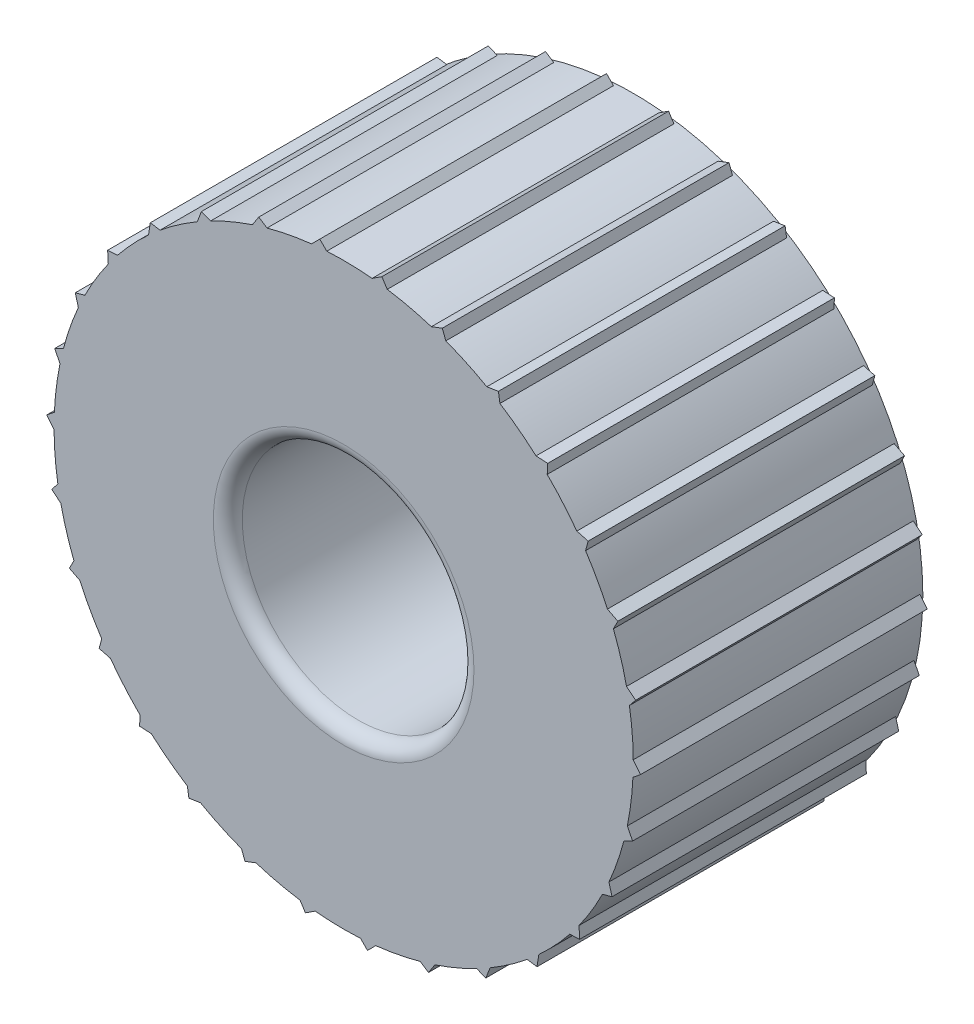
from build123d import *

# Parameters (mm, degrees)
SKETCH2_R           = 100
SKETCH2_R_2         = 50
BOSS_EXTRUDE2_DEPTH = 100
SKETCH3_R           = 50
BOSS_EXTRUDE3_DEPTH = 100
SKETCH4_R           = 40
CUT_EXTRUDE1_DEPTH  = 100
FILLET1_R           = 5
FILLET2_R           = 5
BOSS_EXTRUDE4_DEPTH = 99


with BuildPart() as part:
    # Sketch2 → Boss-Extrude2 (new body)
    with BuildSketch(Plane.XY):
        Circle(SKETCH2_R)
        Circle(SKETCH2_R_2, mode=Mode.SUBTRACT)
    extrude(amount=-BOSS_EXTRUDE2_DEPTH)

    # Sketch3 → Boss-Extrude3 (add)
    with BuildSketch(Plane.XY):
        Circle(SKETCH3_R)
    extrude(amount=-BOSS_EXTRUDE3_DEPTH)

    # Sketch4 → Cut-Extrude1 (cut)
    with BuildSketch(Plane.XY):
        Circle(SKETCH4_R)
    extrude(amount=-CUT_EXTRUDE1_DEPTH, mode=Mode.SUBTRACT)

    # Fillet1
    fillet1_edges = [part.edges().sort_by_distance(p)[0] for p in [
        (-40, 0, 0),
    ]]
    fillet(fillet1_edges, radius=FILLET1_R)

    # Fillet2
    fillet2_edges = [part.edges().sort_by_distance(p)[0] for p in [
        (-40, 0, -100),
    ]]
    fillet(fillet2_edges, radius=FILLET2_R)

    # Sketch9 → Boss-Extrude4 (add)
    with BuildSketch(Plane.XY):
        with BuildLine():
            Line((-11.094188182, 99.382689582), (-8.236971303, 102.239906461))
            Line((-8.236971303, 102.239906461), (-5.827142523, 99.830077682))
            ThreePointArc((-5.827142523, 99.830077682), (-8.463621993, 99.641191797), (-11.094188182, 99.382689582))
        make_face()
        with BuildLine():
            Line((13.199898104, 101.718281835), (15.056034767, 98.86008202))
            ThreePointArc((15.056034767, 98.86008202), (12.437897116, 99.22347865), (9.811069477, 99.517550792))
            Line((9.811069477, 99.517550792), (13.199898104, 101.718281835))
        make_face()
        with BuildLine():
            Line((34.059868624, 96.751080194), (35.281191091, 93.569426391))
            ThreePointArc((35.281191091, 93.569426391), (32.795820437, 94.469223358), (30.287536321, 95.303017495))
            Line((30.287536321, 95.303017495), (34.059868624, 96.751080194))
        make_face()
        with BuildLine():
            Line((53.431259448, 87.555392086), (53.964390067, 84.189337833))
            ThreePointArc((53.964390067, 84.189337833), (51.720409033, 85.586209692), (49.440292492, 86.923285018))
            Line((49.440292492, 86.923285018), (53.431259448, 87.555392086))
        make_face()
        with BuildLine():
            Line((70.467447842, 74.533113206), (70.289086246, 71.129771226))
            ThreePointArc((70.289086246, 71.129771226), (68.384567572, 72.962667974), (66.43227064, 74.744587882))
            Line((66.43227064, 74.744587882), (70.467447842, 74.533113206))
        make_face()
        with BuildLine():
            Line((84.423870625, 58.253379629), (83.541812073, 54.961492298))
            ThreePointArc((83.541812073, 54.961492298), (82.059992363, 57.150307552), (80.520839784, 59.299193591))
            Line((80.520839784, 59.299193591), (84.423870625, 58.253379629))
        make_face()
        with BuildLine():
            Line((94.690565151, 39.427693832), (93.143359833, 36.391132422))
            ThreePointArc((93.143359833, 36.391132422), (92.14900172, 38.840204453), (91.090261847, 41.262139991))
            Line((91.090261847, 41.262139991), (94.690565151, 39.427693832))
        make_face()
        with BuildLine():
            Line((100.818827604, 18.878828619), (98.674095818, 16.230305435))
            ThreePointArc((98.674095818, 16.230305435), (98.210657522, 18.832598043), (97.678602368, 21.421732876))
            Line((97.678602368, 21.421732876), (100.818827604, 18.878828619))
        make_face()
        with BuildLine():
            Line((102.540823508, -2.495131995), (99.892300324, -4.639863781))
            ThreePointArc((99.892300324, -4.639863781), (99.980036323, -1.998083271), (99.997919252, 0.645093241))
            Line((99.997919252, 0.645093241), (102.540823508, -2.495131995))
        make_face()
        with BuildLine():
            Line((99.78129338, -23.760043368), (96.74473197, -25.307248685))
            ThreePointArc((96.74473197, -25.307248685), (97.37980778, -22.741438757), (97.946847221, -20.159740064))
            Line((97.946847221, -20.159740064), (99.78129338, -23.760043368))
        make_face()
        with BuildLine():
            Line((92.660841927, -43.986526832), (89.368954596, -44.868585384))
            ThreePointArc((89.368954596, -44.868585384), (90.523614356, -42.490884245), (91.615027965, -40.083495991))
            Line((91.615027965, -40.083495991), (92.660841927, -43.986526832))
        make_face()
        with BuildLine():
            Line((81.490667046, -62.290588003), (78.087325067, -62.468949599))
            ThreePointArc((78.087325067, -62.468949599), (79.711104604, -60.383274197), (81.27919237, -58.255410802))
            Line((81.27919237, -58.255410802), (81.490667046, -62.290588003))
        make_face()
        with BuildLine():
            Line((66.75895898, -77.872251575), (63.392904727, -77.339120956))
            ThreePointArc((63.392904727, -77.339120956), (65.414837085, -75.636625315), (67.391066047, -73.881284619))
            Line((67.391066047, -73.881284619), (66.75895898, -77.872251575))
        make_face()
        with BuildLine():
            Line((49.109564061, -90.050524081), (45.927910258, -88.829201614))
            ThreePointArc((45.927910258, -88.829201614), (48.25962729, -87.584292963), (50.55762676, -86.278191777))
            Line((50.55762676, -86.278191777), (49.109564061, -90.050524081))
        make_face()
        with BuildLine():
            Line((29.313845538, -98.293156574), (26.455645724, -96.437019911))
            ThreePointArc((26.455645724, -96.437019911), (28.995240207, -95.704106732), (31.514576581, -94.904327946))
            Line((31.514576581, -94.904327946), (29.313845538, -98.293156574))
        make_face()
        with BuildLine():
            Line((8.236971303, -102.239906461), (5.827142523, -99.830077682))
            ThreePointArc((5.827142523, -99.830077682), (8.463621993, -99.641191797), (11.094188182, -99.382689582))
            Line((11.094188182, -99.382689582), (8.236971303, -102.239906461))
        make_face()
        with BuildLine():
            Line((-13.199898104, -101.718281835), (-15.056034767, -98.86008202))
            ThreePointArc((-15.056034767, -98.86008202), (-12.437897116, -99.22347865), (-9.811069477, -99.517550792))
            Line((-9.811069477, -99.517550792), (-13.199898104, -101.718281835))
        make_face()
        with BuildLine():
            Line((-34.059868624, -96.751080194), (-35.281191091, -93.569426391))
            ThreePointArc((-35.281191091, -93.569426391), (-32.795820437, -94.469223358), (-30.287536321, -95.303017495))
            Line((-30.287536321, -95.303017495), (-34.059868624, -96.751080194))
        make_face()
        with BuildLine():
            Line((-53.431259448, -87.555392086), (-53.964390067, -84.189337833))
            ThreePointArc((-53.964390067, -84.189337833), (-51.720409033, -85.586209692), (-49.440292492, -86.923285018))
            Line((-49.440292492, -86.923285018), (-53.431259448, -87.555392086))
        make_face()
        with BuildLine():
            Line((-70.467447842, -74.533113206), (-70.289086246, -71.129771226))
            ThreePointArc((-70.289086246, -71.129771226), (-68.384567572, -72.962667974), (-66.43227064, -74.744587882))
            Line((-66.43227064, -74.744587882), (-70.467447842, -74.533113206))
        make_face()
        with BuildLine():
            Line((-84.423870625, -58.253379629), (-83.541812073, -54.961492298))
            ThreePointArc((-83.541812073, -54.961492298), (-82.059992363, -57.150307552), (-80.520839784, -59.299193591))
            Line((-80.520839784, -59.299193591), (-84.423870625, -58.253379629))
        make_face()
        with BuildLine():
            Line((-94.690565151, -39.427693832), (-93.143359833, -36.391132422))
            ThreePointArc((-93.143359833, -36.391132422), (-92.14900172, -38.840204453), (-91.090261847, -41.262139991))
            Line((-91.090261847, -41.262139991), (-94.690565151, -39.427693832))
        make_face()
        with BuildLine():
            Line((-100.818827604, -18.878828619), (-98.674095818, -16.230305435))
            ThreePointArc((-98.674095818, -16.230305435), (-98.210657522, -18.832598043), (-97.678602368, -21.421732875))
            Line((-97.678602368, -21.421732875), (-100.818827604, -18.878828619))
        make_face()
        with BuildLine():
            Line((-102.540823508, 2.495131995), (-99.892300324, 4.639863781))
            ThreePointArc((-99.892300324, 4.639863781), (-99.980036323, 1.998083271), (-99.997919252, -0.645093241))
            Line((-99.997919252, -0.645093241), (-102.540823508, 2.495131995))
        make_face()
        with BuildLine():
            Line((-99.78129338, 23.760043368), (-96.74473197, 25.307248685))
            ThreePointArc((-96.74473197, 25.307248685), (-97.37980778, 22.741438757), (-97.946847221, 20.159740064))
            Line((-97.946847221, 20.159740064), (-99.78129338, 23.760043368))
        make_face()
        with BuildLine():
            Line((-92.660841927, 43.986526832), (-89.368954596, 44.868585384))
            ThreePointArc((-89.368954596, 44.868585384), (-90.523614356, 42.490884245), (-91.615027965, 40.083495991))
            Line((-91.615027965, 40.083495991), (-92.660841927, 43.986526832))
        make_face()
        with BuildLine():
            Line((-81.490667046, 62.290588003), (-78.087325067, 62.468949599))
            ThreePointArc((-78.087325067, 62.468949599), (-79.711104604, 60.383274197), (-81.27919237, 58.255410802))
            Line((-81.27919237, 58.255410802), (-81.490667046, 62.290588003))
        make_face()
        with BuildLine():
            Line((-66.75895898, 77.872251575), (-63.392904727, 77.339120956))
            ThreePointArc((-63.392904727, 77.339120956), (-65.414837085, 75.636625315), (-67.391066047, 73.881284619))
            Line((-67.391066047, 73.881284619), (-66.75895898, 77.872251575))
        make_face()
        with BuildLine():
            Line((-49.109564061, 90.050524081), (-45.927910258, 88.829201614))
            ThreePointArc((-45.927910258, 88.829201614), (-48.25962729, 87.584292963), (-50.55762676, 86.278191777))
            Line((-50.55762676, 86.278191777), (-49.109564061, 90.050524081))
        make_face()
        with BuildLine():
            Line((-29.313845538, 98.293156574), (-26.455645724, 96.437019911))
            ThreePointArc((-26.455645724, 96.437019911), (-28.995240207, 95.704106732), (-31.514576581, 94.904327946))
            Line((-31.514576581, 94.904327946), (-29.313845538, 98.293156574))
        make_face()
    extrude(amount=-BOSS_EXTRUDE4_DEPTH)


solid = part.part
